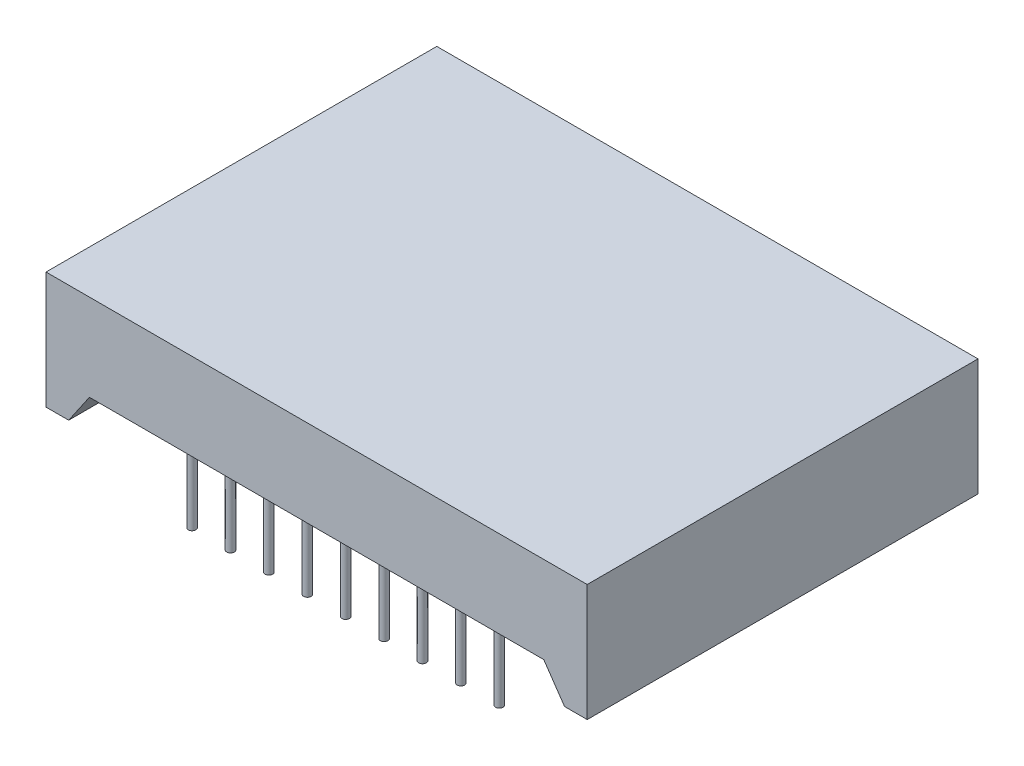
from build123d import *

# Parameters (mm, degrees)
SKETCH_1_W                  = 35.8
SKETCH_1_H                  = 25.85
EXTRUDE_1_DEPTH             = 7.74
CUT_EXTRUDE_1_DEPTH         = 33.38116891
CUT_EXTRUDE_1_DEPTH_BACK    = 33.38116891
SKETCH_1_4_R                = 0.25
EXTRUDE_2_DEPTH             = 4
EXTRUDE_2_DIRECTION_2_REACH = 25.396


with BuildPart() as part:
    # Эскиз1 → Бобышка-Вытянуть1 (new body)
    with BuildSketch(Plane(origin=(0, 0, 0), x_dir=(1, 0, 0), z_dir=(0, 1, 0))):
        Rectangle(SKETCH_1_W, SKETCH_1_H)
    extrude(amount=EXTRUDE_1_DEPTH)

    # Эскиз2 → Вырез-Вытянуть1 (cut, two sides: drawn at the far end of the back side and taken through both)
    with BuildSketch(Plane.XY.offset(12.925).offset(-CUT_EXTRUDE_1_DEPTH_BACK)):
        Polygon((-61.847664635, -66.231397496), (-16.4, 0), (-15.027609673, 2), (15.027609673, 2), (16.4, 0), (61.847664635, -66.231397496), (61.847664635, -226.881181001), (-61.847664635, -226.881181001), align=None)
    extrude(amount=CUT_EXTRUDE_1_DEPTH + CUT_EXTRUDE_1_DEPTH_BACK, mode=Mode.SUBTRACT)

    # Эскиз1<4> → Бобышка-Вытянуть2 (add)
    with BuildSketch(Plane(origin=(0, 0, 0), x_dir=(1, 0, 0), z_dir=(0, 1, 0))):
        with Locations((-10.16, -11)):
            Circle(SKETCH_1_4_R)
        with Locations((-7.62, -11)):
            Circle(SKETCH_1_4_R)
        with Locations((-5.08, -11)):
            Circle(SKETCH_1_4_R)
        with Locations((-2.54, -11)):
            Circle(SKETCH_1_4_R)
        with Locations((0, -11)):
            Circle(SKETCH_1_4_R)
        with Locations((2.54, -11)):
            Circle(SKETCH_1_4_R)
        with Locations((5.08, -11)):
            Circle(SKETCH_1_4_R)
        with Locations((7.62, -11)):
            Circle(SKETCH_1_4_R)
        with Locations((10.16, -11)):
            Circle(SKETCH_1_4_R)
        with Locations((10.16, 11)):
            Circle(SKETCH_1_4_R)
        with Locations((7.62, 11)):
            Circle(SKETCH_1_4_R)
        with Locations((5.08, 11)):
            Circle(SKETCH_1_4_R)
        with Locations((2.54, 11)):
            Circle(SKETCH_1_4_R)
        with Locations((0, 11)):
            Circle(SKETCH_1_4_R)
        with Locations((-2.54, 11)):
            Circle(SKETCH_1_4_R)
        with Locations((-5.08, 11)):
            Circle(SKETCH_1_4_R)
        with Locations((-7.62, 11)):
            Circle(SKETCH_1_4_R)
        with Locations((-10.16, 11)):
            Circle(SKETCH_1_4_R)
    extrude(amount=-EXTRUDE_2_DEPTH)

    # Эскиз1<4> → Бобышка-Вытянуть2 direction 2 (add, up to next)
    with BuildSketch(Plane(origin=(0, 0, 0), x_dir=(1, 0, 0), z_dir=(0, 1, 0)), mode=Mode.PRIVATE) as extrude_2_direction_2_sk1:
        with Locations((-10.16, -11)):
            Circle(SKETCH_1_4_R)
    extrude_2_direction_2_tool1 = extrude(extrude_2_direction_2_sk1.sketch, amount=EXTRUDE_2_DIRECTION_2_REACH, mode=Mode.PRIVATE) - part.part
    # Эскиз1<4> → Бобышка-Вытянуть2 direction 2 (add, up to next)
    with BuildSketch(Plane(origin=(0, 0, 0), x_dir=(1, 0, 0), z_dir=(0, 1, 0)), mode=Mode.PRIVATE) as extrude_2_direction_2_sk2:
        with Locations((-7.62, -11)):
            Circle(SKETCH_1_4_R)
    extrude_2_direction_2_tool2 = extrude(extrude_2_direction_2_sk2.sketch, amount=EXTRUDE_2_DIRECTION_2_REACH, mode=Mode.PRIVATE) - part.part
    # Эскиз1<4> → Бобышка-Вытянуть2 direction 2 (add, up to next)
    with BuildSketch(Plane(origin=(0, 0, 0), x_dir=(1, 0, 0), z_dir=(0, 1, 0)), mode=Mode.PRIVATE) as extrude_2_direction_2_sk3:
        with Locations((-5.08, -11)):
            Circle(SKETCH_1_4_R)
    extrude_2_direction_2_tool3 = extrude(extrude_2_direction_2_sk3.sketch, amount=EXTRUDE_2_DIRECTION_2_REACH, mode=Mode.PRIVATE) - part.part
    # Эскиз1<4> → Бобышка-Вытянуть2 direction 2 (add, up to next)
    with BuildSketch(Plane(origin=(0, 0, 0), x_dir=(1, 0, 0), z_dir=(0, 1, 0)), mode=Mode.PRIVATE) as extrude_2_direction_2_sk4:
        with Locations((-2.54, -11)):
            Circle(SKETCH_1_4_R)
    extrude_2_direction_2_tool4 = extrude(extrude_2_direction_2_sk4.sketch, amount=EXTRUDE_2_DIRECTION_2_REACH, mode=Mode.PRIVATE) - part.part
    # Эскиз1<4> → Бобышка-Вытянуть2 direction 2 (add, up to next)
    with BuildSketch(Plane(origin=(0, 0, 0), x_dir=(1, 0, 0), z_dir=(0, 1, 0)), mode=Mode.PRIVATE) as extrude_2_direction_2_sk5:
        with Locations((0, -11)):
            Circle(SKETCH_1_4_R)
    extrude_2_direction_2_tool5 = extrude(extrude_2_direction_2_sk5.sketch, amount=EXTRUDE_2_DIRECTION_2_REACH, mode=Mode.PRIVATE) - part.part
    # Эскиз1<4> → Бобышка-Вытянуть2 direction 2 (add, up to next)
    with BuildSketch(Plane(origin=(0, 0, 0), x_dir=(1, 0, 0), z_dir=(0, 1, 0)), mode=Mode.PRIVATE) as extrude_2_direction_2_sk6:
        with Locations((2.54, -11)):
            Circle(SKETCH_1_4_R)
    extrude_2_direction_2_tool6 = extrude(extrude_2_direction_2_sk6.sketch, amount=EXTRUDE_2_DIRECTION_2_REACH, mode=Mode.PRIVATE) - part.part
    # Эскиз1<4> → Бобышка-Вытянуть2 direction 2 (add, up to next)
    with BuildSketch(Plane(origin=(0, 0, 0), x_dir=(1, 0, 0), z_dir=(0, 1, 0)), mode=Mode.PRIVATE) as extrude_2_direction_2_sk7:
        with Locations((5.08, -11)):
            Circle(SKETCH_1_4_R)
    extrude_2_direction_2_tool7 = extrude(extrude_2_direction_2_sk7.sketch, amount=EXTRUDE_2_DIRECTION_2_REACH, mode=Mode.PRIVATE) - part.part
    # Эскиз1<4> → Бобышка-Вытянуть2 direction 2 (add, up to next)
    with BuildSketch(Plane(origin=(0, 0, 0), x_dir=(1, 0, 0), z_dir=(0, 1, 0)), mode=Mode.PRIVATE) as extrude_2_direction_2_sk8:
        with Locations((7.62, -11)):
            Circle(SKETCH_1_4_R)
    extrude_2_direction_2_tool8 = extrude(extrude_2_direction_2_sk8.sketch, amount=EXTRUDE_2_DIRECTION_2_REACH, mode=Mode.PRIVATE) - part.part
    # Эскиз1<4> → Бобышка-Вытянуть2 direction 2 (add, up to next)
    with BuildSketch(Plane(origin=(0, 0, 0), x_dir=(1, 0, 0), z_dir=(0, 1, 0)), mode=Mode.PRIVATE) as extrude_2_direction_2_sk9:
        with Locations((10.16, -11)):
            Circle(SKETCH_1_4_R)
    extrude_2_direction_2_tool9 = extrude(extrude_2_direction_2_sk9.sketch, amount=EXTRUDE_2_DIRECTION_2_REACH, mode=Mode.PRIVATE) - part.part
    # Эскиз1<4> → Бобышка-Вытянуть2 direction 2 (add, up to next)
    with BuildSketch(Plane(origin=(0, 0, 0), x_dir=(1, 0, 0), z_dir=(0, 1, 0)), mode=Mode.PRIVATE) as extrude_2_direction_2_sk10:
        with Locations((10.16, 11)):
            Circle(SKETCH_1_4_R)
    extrude_2_direction_2_tool10 = extrude(extrude_2_direction_2_sk10.sketch, amount=EXTRUDE_2_DIRECTION_2_REACH, mode=Mode.PRIVATE) - part.part
    # Эскиз1<4> → Бобышка-Вытянуть2 direction 2 (add, up to next)
    with BuildSketch(Plane(origin=(0, 0, 0), x_dir=(1, 0, 0), z_dir=(0, 1, 0)), mode=Mode.PRIVATE) as extrude_2_direction_2_sk11:
        with Locations((7.62, 11)):
            Circle(SKETCH_1_4_R)
    extrude_2_direction_2_tool11 = extrude(extrude_2_direction_2_sk11.sketch, amount=EXTRUDE_2_DIRECTION_2_REACH, mode=Mode.PRIVATE) - part.part
    # Эскиз1<4> → Бобышка-Вытянуть2 direction 2 (add, up to next)
    with BuildSketch(Plane(origin=(0, 0, 0), x_dir=(1, 0, 0), z_dir=(0, 1, 0)), mode=Mode.PRIVATE) as extrude_2_direction_2_sk12:
        with Locations((5.08, 11)):
            Circle(SKETCH_1_4_R)
    extrude_2_direction_2_tool12 = extrude(extrude_2_direction_2_sk12.sketch, amount=EXTRUDE_2_DIRECTION_2_REACH, mode=Mode.PRIVATE) - part.part
    # Эскиз1<4> → Бобышка-Вытянуть2 direction 2 (add, up to next)
    with BuildSketch(Plane(origin=(0, 0, 0), x_dir=(1, 0, 0), z_dir=(0, 1, 0)), mode=Mode.PRIVATE) as extrude_2_direction_2_sk13:
        with Locations((2.54, 11)):
            Circle(SKETCH_1_4_R)
    extrude_2_direction_2_tool13 = extrude(extrude_2_direction_2_sk13.sketch, amount=EXTRUDE_2_DIRECTION_2_REACH, mode=Mode.PRIVATE) - part.part
    # Эскиз1<4> → Бобышка-Вытянуть2 direction 2 (add, up to next)
    with BuildSketch(Plane(origin=(0, 0, 0), x_dir=(1, 0, 0), z_dir=(0, 1, 0)), mode=Mode.PRIVATE) as extrude_2_direction_2_sk14:
        with Locations((0, 11)):
            Circle(SKETCH_1_4_R)
    extrude_2_direction_2_tool14 = extrude(extrude_2_direction_2_sk14.sketch, amount=EXTRUDE_2_DIRECTION_2_REACH, mode=Mode.PRIVATE) - part.part
    # Эскиз1<4> → Бобышка-Вытянуть2 direction 2 (add, up to next)
    with BuildSketch(Plane(origin=(0, 0, 0), x_dir=(1, 0, 0), z_dir=(0, 1, 0)), mode=Mode.PRIVATE) as extrude_2_direction_2_sk15:
        with Locations((-2.54, 11)):
            Circle(SKETCH_1_4_R)
    extrude_2_direction_2_tool15 = extrude(extrude_2_direction_2_sk15.sketch, amount=EXTRUDE_2_DIRECTION_2_REACH, mode=Mode.PRIVATE) - part.part
    # Эскиз1<4> → Бобышка-Вытянуть2 direction 2 (add, up to next)
    with BuildSketch(Plane(origin=(0, 0, 0), x_dir=(1, 0, 0), z_dir=(0, 1, 0)), mode=Mode.PRIVATE) as extrude_2_direction_2_sk16:
        with Locations((-5.08, 11)):
            Circle(SKETCH_1_4_R)
    extrude_2_direction_2_tool16 = extrude(extrude_2_direction_2_sk16.sketch, amount=EXTRUDE_2_DIRECTION_2_REACH, mode=Mode.PRIVATE) - part.part
    # Эскиз1<4> → Бобышка-Вытянуть2 direction 2 (add, up to next)
    with BuildSketch(Plane(origin=(0, 0, 0), x_dir=(1, 0, 0), z_dir=(0, 1, 0)), mode=Mode.PRIVATE) as extrude_2_direction_2_sk17:
        with Locations((-7.62, 11)):
            Circle(SKETCH_1_4_R)
    extrude_2_direction_2_tool17 = extrude(extrude_2_direction_2_sk17.sketch, amount=EXTRUDE_2_DIRECTION_2_REACH, mode=Mode.PRIVATE) - part.part
    # Эскиз1<4> → Бобышка-Вытянуть2 direction 2 (add, up to next)
    with BuildSketch(Plane(origin=(0, 0, 0), x_dir=(1, 0, 0), z_dir=(0, 1, 0)), mode=Mode.PRIVATE) as extrude_2_direction_2_sk18:
        with Locations((-10.16, 11)):
            Circle(SKETCH_1_4_R)
    extrude_2_direction_2_tool18 = extrude(extrude_2_direction_2_sk18.sketch, amount=EXTRUDE_2_DIRECTION_2_REACH, mode=Mode.PRIVATE) - part.part
    add(extrude_2_direction_2_tool1.solids().sort_by_distance((-10.16, 0, 11))[0])
    add(extrude_2_direction_2_tool2.solids().sort_by_distance((-7.62, 0, 11))[0])
    add(extrude_2_direction_2_tool3.solids().sort_by_distance((-5.08, 0, 11))[0])
    add(extrude_2_direction_2_tool4.solids().sort_by_distance((-2.54, 0, 11))[0])
    add(extrude_2_direction_2_tool5.solids().sort_by_distance((0, 0, 11))[0])
    add(extrude_2_direction_2_tool6.solids().sort_by_distance((2.54, 0, 11))[0])
    add(extrude_2_direction_2_tool7.solids().sort_by_distance((5.08, 0, 11))[0])
    add(extrude_2_direction_2_tool8.solids().sort_by_distance((7.62, 0, 11))[0])
    add(extrude_2_direction_2_tool9.solids().sort_by_distance((10.16, 0, 11))[0])
    add(extrude_2_direction_2_tool10.solids().sort_by_distance((10.16, 0, -11))[0])
    add(extrude_2_direction_2_tool11.solids().sort_by_distance((7.62, 0, -11))[0])
    add(extrude_2_direction_2_tool12.solids().sort_by_distance((5.08, 0, -11))[0])
    add(extrude_2_direction_2_tool13.solids().sort_by_distance((2.54, 0, -11))[0])
    add(extrude_2_direction_2_tool14.solids().sort_by_distance((0, 0, -11))[0])
    add(extrude_2_direction_2_tool15.solids().sort_by_distance((-2.54, 0, -11))[0])
    add(extrude_2_direction_2_tool16.solids().sort_by_distance((-5.08, 0, -11))[0])
    add(extrude_2_direction_2_tool17.solids().sort_by_distance((-7.62, 0, -11))[0])
    add(extrude_2_direction_2_tool18.solids().sort_by_distance((-10.16, 0, -11))[0])


solid = part.part
